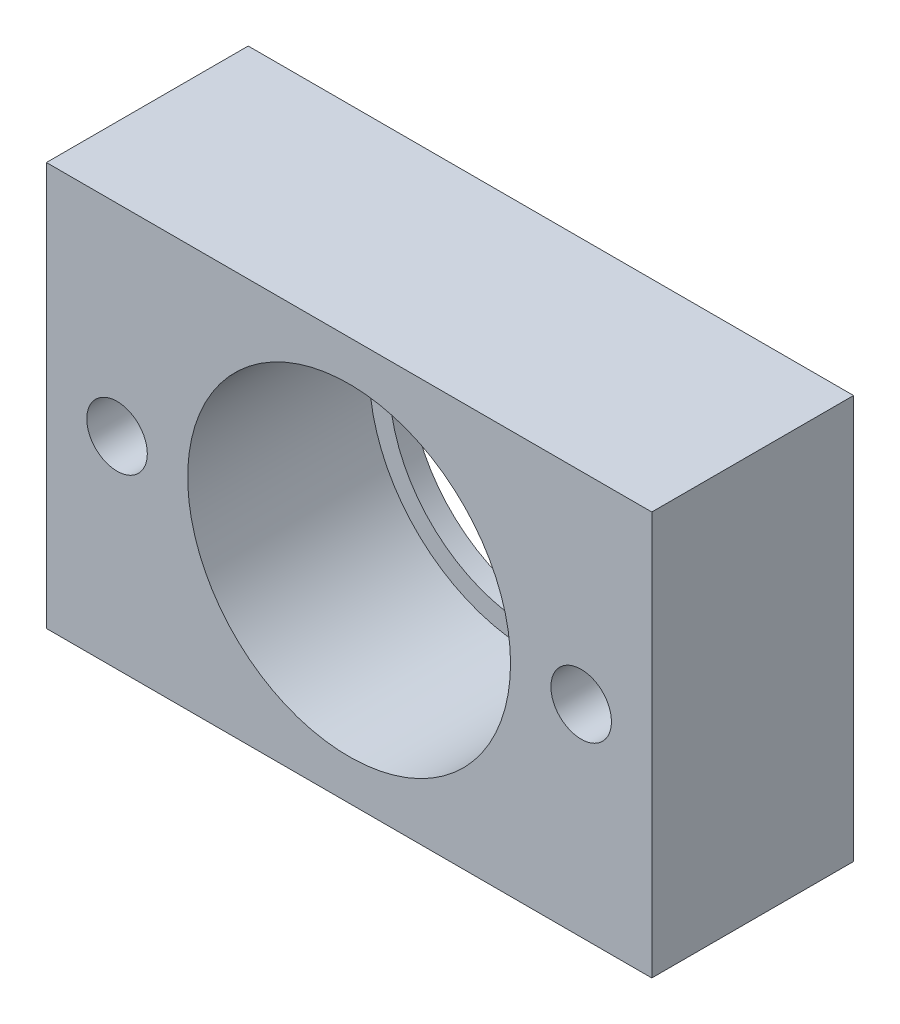
from build123d import *

# Parameters (mm, degrees)
SKETCH1_W           = 30
SKETCH1_H           = 20
SKETCH1_R           = 1.5
SKETCH1_R_2         = 8
BOSS_EXTRUDE1_DEPTH = 10
SKETCH1_3_R         = 8
SKETCH1_3_R_2       = 7
BOSS_EXTRUDE2_DEPTH = 1


with BuildPart() as part:
    # Sketch1 → Boss-Extrude1 (new body)
    with BuildSketch(Plane.XY):
        with Locations((7.259887006, 7.881355932)):
            Rectangle(SKETCH1_W, SKETCH1_H)
        with Locations((-4.240112994, 7.881355932)):
            Circle(SKETCH1_R, mode=Mode.SUBTRACT)
        with Locations((7.259887006, 7.881355932)):
            Circle(SKETCH1_R_2, mode=Mode.SUBTRACT)
        with Locations((18.759887006, 7.881355932)):
            Circle(SKETCH1_R, mode=Mode.SUBTRACT)
    extrude(amount=BOSS_EXTRUDE1_DEPTH)

    # Sketch1<3> → Boss-Extrude2 (add)
    with BuildSketch(Plane.XY):
        with Locations((7.259887006, 7.881355932)):
            Circle(SKETCH1_3_R)
        with Locations((7.259887006, 7.881355932)):
            Circle(SKETCH1_3_R_2, mode=Mode.SUBTRACT)
    extrude(amount=BOSS_EXTRUDE2_DEPTH)


solid = part.part
